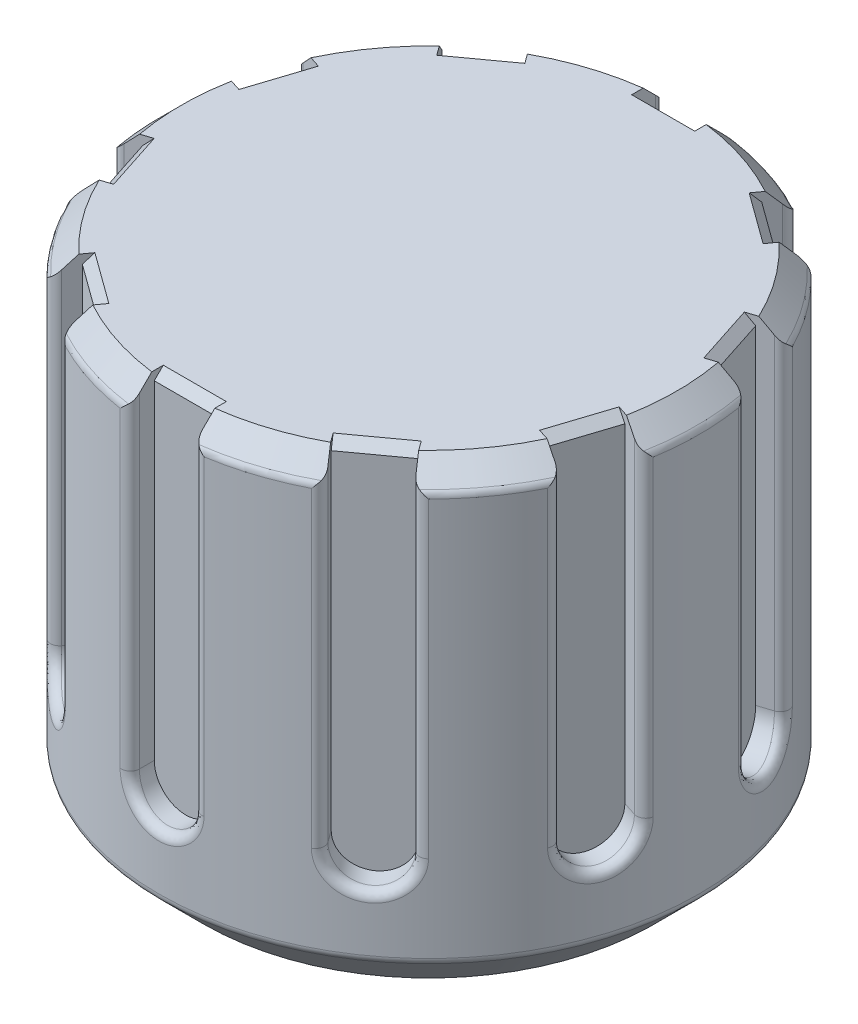
from build123d import *

# Parameters (mm, degrees)
SKETCH_1_R               = 6
EXTRUDE_1_DEPTH          = 11
SKETCH_2_R               = 3.75
CUT_EXTRUDE_1_DEPTH      = 2.5
SKETCH_4_R               = 3.1
CUT_EXTRUDE_2_DEPTH      = 8.5
SKETCH_5_R               = 13.5
CUT_EXTRUDE_3_DEPTH      = 0.5
CHAMFER_1_SIZE           = 0.5
CUT_EXTRUDE_START        = -5.4
CUT_EXTRUDE_4_DEPTH      = 4
PATTERN_CIRCULAR_1_COUNT = 10
CHAMFER_2_SIZE           = 0.2
CHAMFER_3_SIZE           = 0.4
CHAMFER_4_SIZE           = 1
FILLET_4_R               = 0.2


with BuildPart() as part:
    # 草图1 → 凸台-拉伸1 (new body)
    with BuildSketch(Plane(origin=(0, 0, 0), x_dir=(1, 0, 0), z_dir=(0, 1, 0))):
        with Locations(Location((0, 0, 0), (0, 0, 270))):
            Circle(SKETCH_1_R)
    extrude(amount=EXTRUDE_1_DEPTH)

    # 草图2 → 切除-拉伸1 (cut)
    with BuildSketch(Plane.XZ):
        with Locations(Location((0, 0, 0), (0, 0, 270))):
            Circle(SKETCH_2_R)
    extrude(amount=-CUT_EXTRUDE_1_DEPTH, mode=Mode.SUBTRACT)

    # 草图4 → 切除-拉伸2 (cut)
    with BuildSketch(Plane.XZ):
        with Locations(Location((0, 0, 0), (0, 0, 270))):
            Circle(SKETCH_4_R)
    extrude(amount=-CUT_EXTRUDE_2_DEPTH, mode=Mode.SUBTRACT)

    # 草图5 → 切除-拉伸3 (cut)
    with BuildSketch(Plane(origin=(0, 11, 0), x_dir=(1, 0, 0), z_dir=(0, 1, 0))):
        Circle(SKETCH_5_R)
    extrude(amount=-CUT_EXTRUDE_3_DEPTH, mode=Mode.SUBTRACT)

    # 倒角1
    chamfer_1_edges = [part.edges().sort_by_distance(p)[0] for p in [
        (0, 10.5, -6),
    ]]
    chamfer(chamfer_1_edges, length=CHAMFER_1_SIZE)

    # 草图6 → 切除-拉伸4 (cut)
    with BuildSketch(Plane.XY.offset(CUT_EXTRUDE_START)):
        with BuildLine():
            Line((0.7, 43), (0.7, 3))
            ThreePointArc((0.7, 3), (0, 2.3), (-0.7, 3))
            Line((-0.7, 3), (-0.7, 43))
            ThreePointArc((-0.7, 43), (0, 43.7), (0.7, 43))
        make_face()
    cut_extrude_4 = extrude(amount=-CUT_EXTRUDE_4_DEPTH, mode=Mode.SUBTRACT)

    # 阵列(圆周)1: 切除-拉伸4 ×10 about axis
    pattern_circular_1_axis = Axis((0, 0, 0), (0, 1, 0))
    for i in range(1, PATTERN_CIRCULAR_1_COUNT):
        add(cut_extrude_4.rotate(pattern_circular_1_axis, i * 360 / PATTERN_CIRCULAR_1_COUNT), mode=Mode.SUBTRACT)

    # 倒角2
    chamfer_2_edges = [part.edges().sort_by_distance(p)[0] for p in [
        (0, 10.5, -5.4),
        (-3.174040362, 10.5, -4.36869177),
        (-5.135705188, 10.5, -1.66869177),
        (-5.135705188, 10.5, 1.66869177),
        (-3.174040362, 10.5, 4.36869177),
        (0, 10.5, 5.4),
        (3.174040362, 10.5, 4.36869177),
        (5.135705188, 10.5, 1.66869177),
        (5.135705188, 10.5, -1.66869177),
        (3.174040362, 10.5, -4.36869177),
    ]]
    chamfer(chamfer_2_edges, length=CHAMFER_2_SIZE)

    # 倒角3
    chamfer_3_edges = [part.edges().sort_by_distance(p)[0] for p in [
        (0, 0, 3.75),
    ]]
    chamfer(chamfer_3_edges, length=CHAMFER_3_SIZE)

    # 倒角4
    chamfer_4_edges = [part.edges().sort_by_distance(p)[0] for p in [
        (0, 0, -6),
    ]]
    chamfer(chamfer_4_edges, length=CHAMFER_4_SIZE)

    # 圆角4
    fillet_4_edges = [part.edges().sort_by_distance(p)[0] for p in [
        (0, 2.3, -6),
        (-0.7, 6.5, -5.959026766),
        (0.7, 6.5, -5.959026766),
        (-3.526711514, 2.3, -4.854101966),
        (-4.068939947, 6.5, -4.409504247),
        (-2.936316155, 6.5, -5.2324036),
        (4.068939947, 6.5, -4.409504247),
        (2.936316155, 6.5, -5.2324036),
        (4.068939947, 6.5, -4.409504247),
        (5.706339098, 2.3, -1.854101966),
        (5.451059341, 6.5, -2.507180102),
        (5.883683133, 6.5, -1.175700979),
        (5.451059341, 6.5, 2.507180102),
        (5.883683133, 6.5, 1.175700979),
        (5.451059341, 6.5, 2.507180102),
        (2.936316155, 6.5, 5.2324036),
        (4.068939947, 6.5, 4.409504247),
        (2.936316155, 6.5, 5.2324036),
        (-0.7, 6.5, 5.959026766),
        (0.7, 6.5, 5.959026766),
        (-0.7, 6.5, 5.959026766),
        (-4.068939947, 6.5, 4.409504247),
        (-2.936316155, 6.5, 5.2324036),
        (-4.068939947, 6.5, 4.409504247),
        (-5.883683133, 6.5, 1.175700979),
        (-5.451059341, 6.5, 2.507180102),
        (-5.883683133, 6.5, 1.175700979),
        (-5.451059341, 6.5, -2.507180102),
        (-5.883683133, 6.5, -1.175700979),
        (-5.451059341, 6.5, -2.507180102),
        (-6, 10, 0),
        (-4.854101966, 10, 3.526711514),
        (-1.854101966, 10, 5.706339098),
        (1.854101966, 10, 5.706339098),
        (4.854101966, 10, 3.526711514),
        (6, 10, 0),
        (4.854101966, 10, -3.526711514),
        (-4.854101966, 10, -3.526711514),
        (-1.854101966, 10, -5.706339098),
        (1.854101966, 10, -5.706339098),
        (0, 1, -6),
    ]]
    fillet(fillet_4_edges, radius=FILLET_4_R)


solid = part.part
